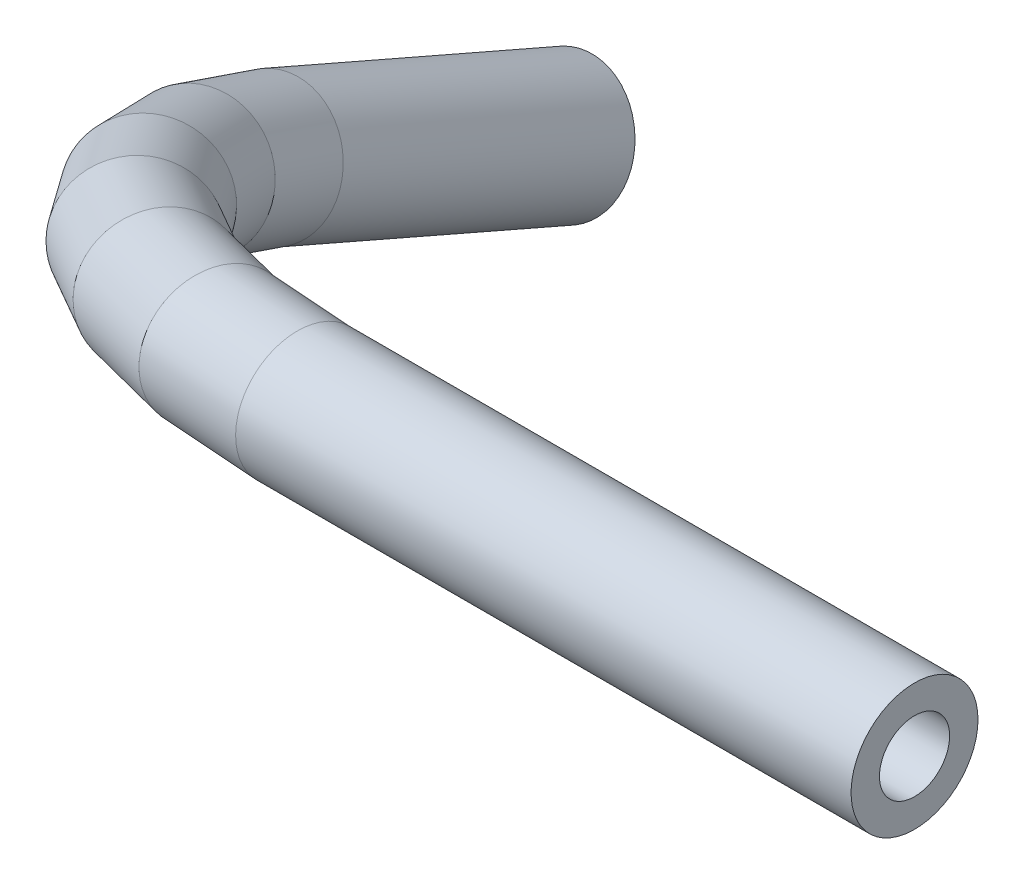
from build123d import *

# Parameters (mm, degrees)
PROFILE_R   = 1.5875
PROFILE_R_2 = 0.8775


with BuildPart() as part:
    # Tube: sweep along a curve in space
    with BuildLine() as tube_path:
        Line((-29.2, -13, 22.516660498), (-44.5, -13, 22.516660498))
        Line((-44.5, -13, 22.516660498), (-46.958780928, -13.129181985, 22.21984959))
        Line((-46.958780928, -13.129181985, 22.21984959), (-49.25, -13.507924402, 21.349644038))
        Line((-49.25, -13.507924402, 21.349644038), (-51.217514421, -14.11041658, 19.965346912))
        Line((-51.217514421, -14.11041658, 19.965346912), (-52.727241336, -14.895599674, 18.161295775))
        Line((-52.727241336, -14.895599674, 18.161295775), (-53.67629535, -15.809964752, 16.060433729))
        Line((-53.67629535, -15.809964752, 16.060433729), (-54, -16.791199347, 13.805931051))
        Line((-54, -16.791199347, 13.805931051), (-54, -20.006484691, 6.418432225))
    # Profile → Tube (sweep)
    with BuildSketch(Plane(origin=(-29.2, 0, 0), x_dir=(0, 0, -1), z_dir=(1, 0, 0))):
        with Locations((-22.516660498, -13)):
            Circle(PROFILE_R)
        with Locations((-22.516660498, -13)):
            Circle(PROFILE_R_2, mode=Mode.SUBTRACT)
    sweep(path=tube_path.line, transition=Transition.RIGHT)


solid = part.part
